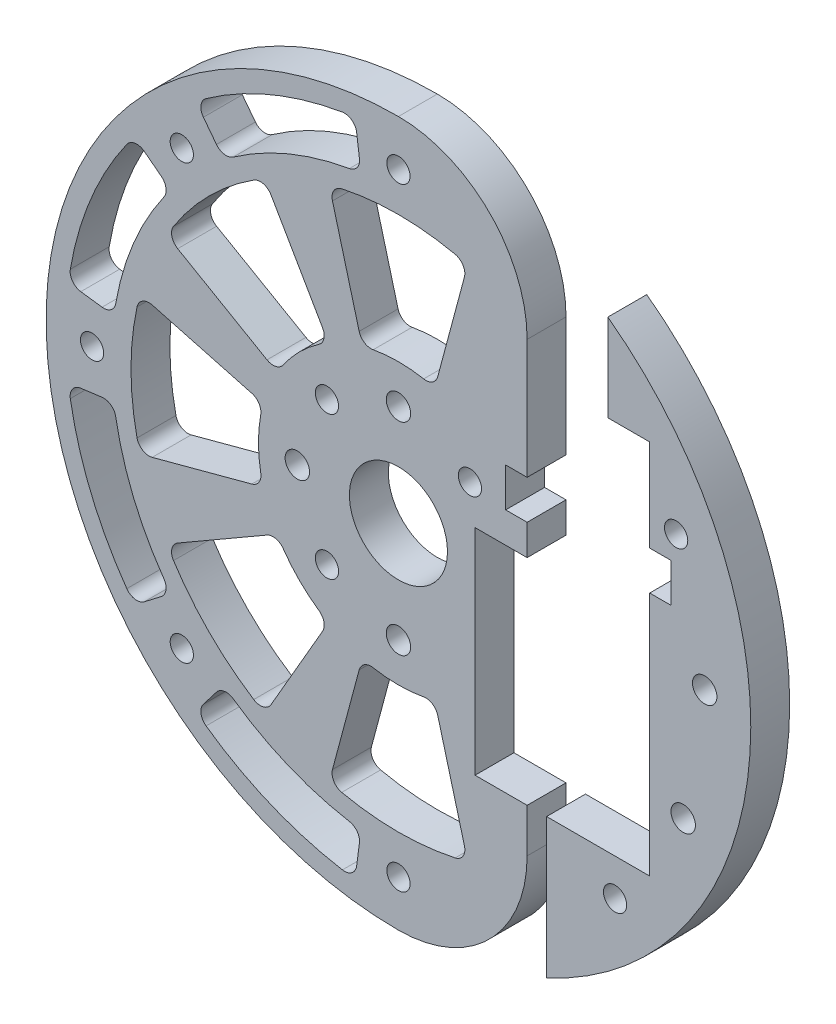
from build123d import *

# Parameters (mm, degrees)
SKETCH1_R                = 57.5
SKETCH1_R_2              = 1.89865
SKETCH1_R_3              = 1.9939
SKETCH1_R_4              = 8
BOSS_EXTRUDE1_DEPTH      = 6.35
CUT_EXTRUDE1_DEPTH       = 82.564836173
SKETCH3_W                = 6.35
SKETCH3_H                = 80
CUT_EXTRUDE3_DEPTH       = 82.564836173
CUT_EXTRUDE5_DEPTH       = 82.564836173
CUT_EXTRUDE6_DEPTH       = 82.564836173
CUT_EXTRUDE7_DEPTH       = 82.564836173
FILLET1_R                = 2
CIRPATTERN1_COUNT        = 8
FILLET1_OF_CIRPATTERN1_R = 2
CUT_EXTRUDE8_DEPTH       = 82.564836173
FILLET2_R                = 2
CIRPATTERN2_COUNT        = 8
FILLET2_OF_CIRPATTERN2_R = 2


with BuildPart() as part:
    # Sketch1 → Boss-Extrude1 (new body)
    with BuildSketch(Plane.XY):
        Circle(SKETCH1_R)
        with Locations((45.315389352, 21.130913087)):
            Circle(SKETCH1_R_2, mode=Mode.SUBTRACT)
        with Locations((49.978847504, 1.454235937)):
            Circle(SKETCH1_R_3, mode=Mode.SUBTRACT)
        Circle(SKETCH1_R_4, mode=Mode.SUBTRACT)
        with Locations((46.467376211, -18.460307366)):
            Circle(SKETCH1_R_3, mode=Mode.SUBTRACT)
        with Locations((0, -16.5)):
            Circle(SKETCH1_R_3, mode=Mode.SUBTRACT)
        with Locations((0, -50)):
            Circle(SKETCH1_R_2, mode=Mode.SUBTRACT)
        with Locations((-16.5, 0)):
            Circle(SKETCH1_R_3, mode=Mode.SUBTRACT)
        with Locations((-11.66726189, -11.66726189)):
            Circle(SKETCH1_R_2, mode=Mode.SUBTRACT)
        with Locations((0, 16.5)):
            Circle(SKETCH1_R_3, mode=Mode.SUBTRACT)
        with Locations((-11.66726189, 11.66726189)):
            Circle(SKETCH1_R_2, mode=Mode.SUBTRACT)
        with Locations((11.66726189, 11.66726189)):
            Circle(SKETCH1_R_2, mode=Mode.SUBTRACT)
        with Locations((-35.355339059, -35.355339059)):
            Circle(SKETCH1_R_2, mode=Mode.SUBTRACT)
        with Locations((-50, 0)):
            Circle(SKETCH1_R_2, mode=Mode.SUBTRACT)
        with Locations((-35.355339059, 35.355339059)):
            Circle(SKETCH1_R_2, mode=Mode.SUBTRACT)
        with Locations((0, 50)):
            Circle(SKETCH1_R_2, mode=Mode.SUBTRACT)
        with Locations((35.355339059, -35.355339059)):
            Circle(SKETCH1_R_2, mode=Mode.SUBTRACT)
    extrude(amount=BOSS_EXTRUDE1_DEPTH)

    # Sketch2 → Cut-Extrude1 (cut, through all)
    with BuildSketch(Plane.XY):
        Polygon((12.5, -29.35), (41, -29.35), (41, 10.65), (44.5, 10.65), (44.5, 17), (41, 17), (41, 32), (21, 32), (21, 17), (17.5, 17), (17.5, 10.65), (21, 10.65), (21, 5.65), (12.5, 5.65), align=None)
    extrude(amount=CUT_EXTRUDE1_DEPTH, mode=Mode.SUBTRACT)

    # Sketch3 → Cut-Extrude3 (cut, through all)
    with BuildSketch(Plane(origin=(0, 0, 0), x_dir=(-1, 0, 0), z_dir=(0, 0, -1))):
        with Locations((-31, 32)):
            Rectangle(SKETCH3_W, SKETCH3_H)
    extrude(amount=-CUT_EXTRUDE3_DEPTH, mode=Mode.SUBTRACT)

    # Sketch4 → Cut-Extrude5 (cut, through all)
    with BuildSketch(Plane.XY):
        with BuildLine():
            Line((21, -36.500002949), (21, -5.372089924))
            Line((21, -5.372089924), (24.175, -5.411516926))
            Line((24.175, -5.411516926), (24.175, -57.5))
            Line((24.175, -57.5), (2.949e-06, -57.5))
            ThreePointArc((2.949e-06, -57.5), (14.849243269, -51.349243269), (21, -36.500002949))
        make_face()
        with BuildLine():
            Line((2.949e-06, 57.5), (24.175, 57.5))
            Line((24.175, 57.5), (24.175, 5.411516926))
            Line((24.175, 5.411516926), (21, 5.372089924))
            Line((21, 5.372089924), (21, 36.500002949))
            ThreePointArc((21, 36.500002949), (14.849243269, 51.349243269), (2.949e-06, 57.5))
        make_face()
    extrude(amount=CUT_EXTRUDE5_DEPTH, mode=Mode.SUBTRACT)


with BuildPart() as cut_extrude5_piece_1:
    # of the separate pieces the step leaves, piece 1, a body of its own (cut_extrude5_pieces)
    add(part.part.solids().sort_by_distance((2.949e-06, 57.5, 0))[0])

    # Sketch6 → Cut-Extrude7 (cut, through all)
    with BuildSketch(Plane.XY.offset(6.35)):
        with BuildLine():
            Line((-42.162662318, -11.297451319), (-22.071405131, -5.914015181))
            ThreePointArc((-22.071405131, -5.914015181), (-22.85, 0), (-22.071405131, 5.914015181))
            Line((-22.071405131, 5.914015181), (-42.162662318, 11.297451319))
            ThreePointArc((-42.162662318, 11.297451319), (-43.65, 0), (-42.162662318, -11.297451319))
        make_face()
    cut_extrude7 = extrude(amount=-CUT_EXTRUDE7_DEPTH, mode=Mode.SUBTRACT)

    # Fillet1
    fillet1_edges = [cut_extrude5_piece_1.edges().sort_by_distance(p)[0] for p in [
        (-22.071405131, 5.914015181, 3.175),
        (-22.071405131, -5.914015181, 3.175),
        (-42.162662318, -11.297451319, 3.175),
        (-42.162662318, 11.297451319, 3.175),
    ]]
    fillet(fillet1_edges, radius=FILLET1_R)

    # CirPattern1: Cut-Extrude7 ×8 about axis, 3 skipped
    cirpattern1_axis = Axis((0, 0, 0), (0, 0, -1))
    add([cut_extrude7.rotate(cirpattern1_axis, i * 360 / CIRPATTERN1_COUNT) for i in range(1, CIRPATTERN1_COUNT) if i not in (3, 4, 5)], mode=Mode.SUBTRACT)

    # Fillet1 of CirPattern1
    fillet1_of_cirpattern1_edges = [cut_extrude5_piece_1.edges().sort_by_distance(p)[0] for p in [
        (-11.425, 19.788680476, 3.175),
        (-19.788680476, 11.425, 3.175),
        (-37.802008875, 21.825, 3.175),
        (-21.825, 37.802008875, 3.175),
        (5.914015181, 22.071405131, 3.175),
        (-5.914015181, 22.071405131, 3.175),
        (-11.297451319, 42.162662318, 3.175),
        (11.297451319, 42.162662318, 3.175),
        (-5.914015181, -22.071405131, 3.175),
        (5.914015181, -22.071405131, 3.175),
        (11.297451319, -42.162662318, 3.175),
        (-11.297451319, -42.162662318, 3.175),
        (-19.788680476, -11.425, 3.175),
        (-11.425, -19.788680476, 3.175),
        (-21.825, -37.802008875, 3.175),
        (-37.802008875, -21.825, 3.175),
    ]]
    fillet(fillet1_of_cirpattern1_edges, radius=FILLET1_OF_CIRPATTERN1_R)

    # Sketch7 → Cut-Extrude8 (cut, through all)
    with BuildSketch(Plane.XY.offset(6.35)):
        with BuildLine():
            Line((-43.098920211, 33.070964631), (-37.148770159, 28.505253913))
            ThreePointArc((-37.148770159, 28.505253913), (-43.26065911, 17.91915172), (-46.424405634, 6.111888951))
            Line((-46.424405634, 6.111888951), (-53.860242094, 7.090835392))
            ThreePointArc((-53.860242094, 7.090835392), (-50.189755604, 20.789277463), (-43.098920211, 33.070964631))
        make_face()
    cut_extrude8 = extrude(amount=-CUT_EXTRUDE8_DEPTH, mode=Mode.SUBTRACT)

    # Fillet2
    fillet2_edges = [cut_extrude5_piece_1.edges().sort_by_distance(p)[0] for p in [
        (-53.860242094, 7.090835392, 3.175),
        (-43.098920211, 33.070964631, 3.175),
        (-37.148770159, 28.505253913, 3.175),
        (-46.424405634, 6.111888951, 3.175),
    ]]
    fillet(fillet2_edges, radius=FILLET2_R)

    # CirPattern2: Cut-Extrude8 ×8 about axis, 4 skipped
    cirpattern2_axis = Axis((0, 0, 0), (0, 0, -1))
    add([cut_extrude8.rotate(cirpattern2_axis, i * 360 / CIRPATTERN2_COUNT) for i in range(1, CIRPATTERN2_COUNT) if i not in (2, 3, 4, 5)], mode=Mode.SUBTRACT)

    # Fillet2 of CirPattern2
    fillet2_of_cirpattern2_edges = [cut_extrude5_piece_1.edges().sort_by_distance(p)[0] for p in [
        (-33.070964631, 43.098920211, 3.175),
        (-7.090835392, 53.860242094, 3.175),
        (-6.111888951, 46.424405634, 3.175),
        (-28.505253913, 37.148770159, 3.175),
        (-7.090835392, -53.860242094, 3.175),
        (-33.070964631, -43.098920211, 3.175),
        (-28.505253913, -37.148770159, 3.175),
        (-6.111888951, -46.424405634, 3.175),
        (-43.098920211, -33.070964631, 3.175),
        (-53.860242094, -7.090835392, 3.175),
        (-46.424405634, -6.111888951, 3.175),
        (-37.148770159, -28.505253913, 3.175),
    ]]
    fillet(fillet2_of_cirpattern2_edges, radius=FILLET2_OF_CIRPATTERN2_R)


with BuildPart() as cut_extrude5_piece_2:
    # of the separate pieces the step leaves, piece 2, a body of its own (cut_extrude5_pieces)
    add(part.part.solids().sort_by_distance((24.175, -52.171058787, 0))[0])


with BuildPart() as cut_extrude5_piece_3:
    # of the separate pieces the step leaves, piece 3, a body of its own (cut_extrude5_pieces)
    add(part.part.solids().sort_by_distance((24.175, 52.171058787, 6.35))[0])

    # Sketch5 → Cut-Extrude6 (cut, through all)
    with BuildSketch(Plane.XY.offset(6.35)):
        with BuildLine():
            Line((24.175, 52.171058787), (24.175, 32))
            Line((24.175, 32), (27.825, 32))
            Line((27.825, 32), (27.825, 50.319175023))
            ThreePointArc((27.825, 50.319175023), (26.016482629, 51.277603607), (24.175, 52.171058787))
        make_face()
    extrude(amount=-CUT_EXTRUDE6_DEPTH, mode=Mode.SUBTRACT)


solid = Compound([cut_extrude5_piece_1.part, cut_extrude5_piece_2.part])
